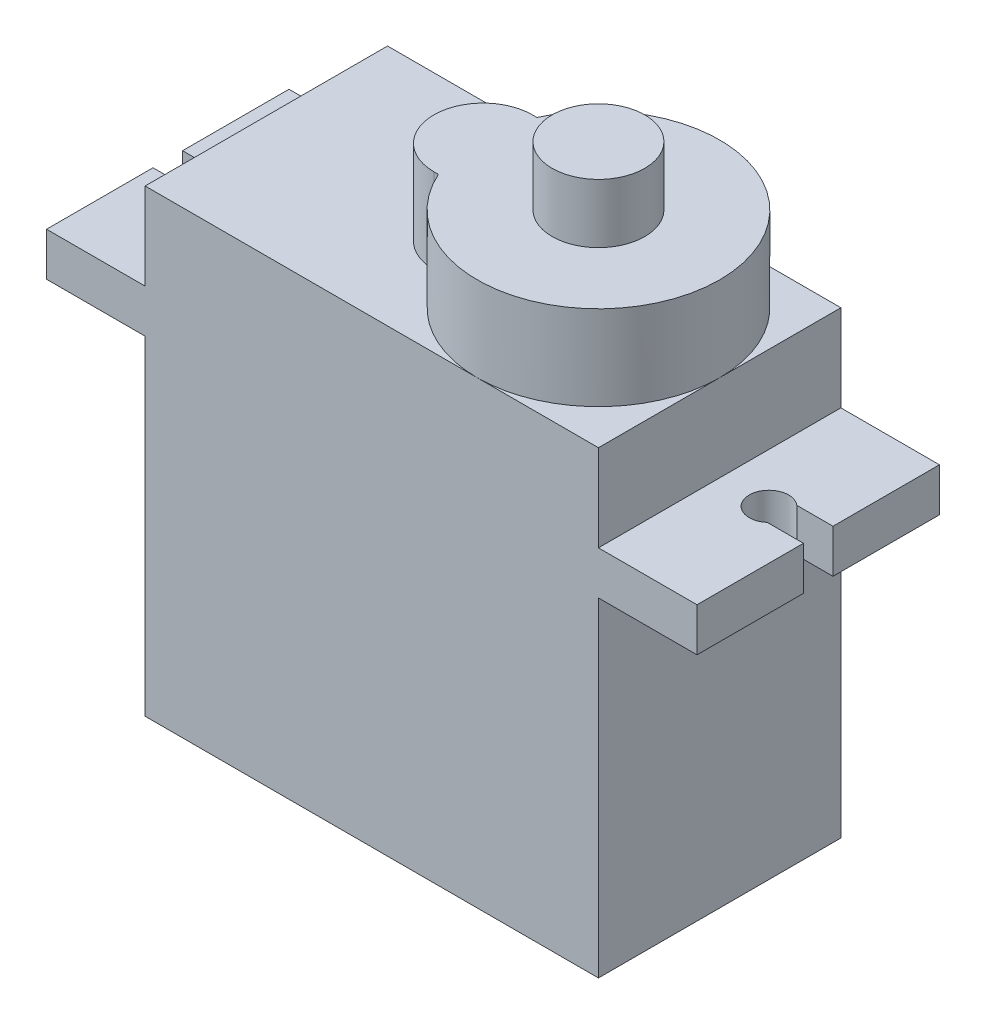
from build123d import *

# Parameters (mm, degrees)
SKETCH_1_W          = 23
SKETCH_1_H          = 12.3
EXTRUDE_1_DEPTH     = 23.3
SKETCH_3_W          = 5
SKETCH_3_H          = 2.2
EXTRUDE_2_DEPTH     = 12.3
CUT_EXTRUDE_1_DEPTH = 36.951356024
EXTRUDE_3_DEPTH     = 4.3
SKETCH_6_R          = 2.35
EXTRUDE_4_DEPTH     = 3


with BuildPart() as part:
    # Эскиз1 → Бобышка-Вытянуть1 (new body)
    with BuildSketch(Plane(origin=(0, 0, 0), x_dir=(1, 0, 0), z_dir=(0, 1, 0))):
        with Locations((11.5, 6.15)):
            Rectangle(SKETCH_1_W, SKETCH_1_H)
    extrude(amount=EXTRUDE_1_DEPTH)

    # Эскиз3 → Бобышка-Вытянуть2 (add)
    with BuildSketch(Plane.XY):
        with Locations((25.5, 17.8)):
            Rectangle(SKETCH_3_W, SKETCH_3_H)
    extrude_2 = extrude(amount=-EXTRUDE_2_DEPTH)

    # Эскиз4 → Вырез-Вытянуть1 (cut, through all)
    with BuildSketch(Plane(origin=(0, 18.9, 0), x_dir=(1, 0, 0), z_dir=(0, 1, 0))):
        with BuildLine():
            Line((28, 6.15), (28, 6.9))
            Line((28, 6.9), (26.161437828, 6.9))
            ThreePointArc((26.161437828, 6.9), (24.5, 6.15), (26.161437828, 5.4))
            Line((26.161437828, 5.4), (28, 5.4))
            Line((28, 5.4), (28, 6.15))
        make_face()
    cut_extrude_1 = extrude(amount=-CUT_EXTRUDE_1_DEPTH, mode=Mode.SUBTRACT)

    # Зеркальное отражение2: Бобышка-Вытянуть2, Вырез-Вытянуть1 across plane
    add(extrude_2.mirror(Plane.ZY.offset(-11.5)))
    add(cut_extrude_1.mirror(Plane.ZY.offset(-11.5)), mode=Mode.SUBTRACT)

    # Эскиз5 → Бобышка-Вытянуть3 (add)
    with BuildSketch(Plane(origin=(0, 23.3, 0), x_dir=(1, 0, 0), z_dir=(0, 1, 0))):
        with BuildLine():
            Line((11, 3.65), (11.231058819, 3.65))
            ThreePointArc((11.231058819, 3.65), (23, 6.15), (11.231058819, 8.65))
            Line((11.231058819, 8.65), (11, 8.65))
            ThreePointArc((11, 8.65), (8.5, 6.15), (11, 3.65))
        make_face()
    extrude(amount=EXTRUDE_3_DEPTH)

    # Эскиз6 → Бобышка-Вытянуть4 (add)
    with BuildSketch(Plane(origin=(0, 27.6, 0), x_dir=(1, 0, 0), z_dir=(0, 1, 0))):
        with Locations(Location((16.85, 6.15, 0), (0, 0, 270))):
            Circle(SKETCH_6_R)
    extrude(amount=EXTRUDE_4_DEPTH)


solid = part.part
